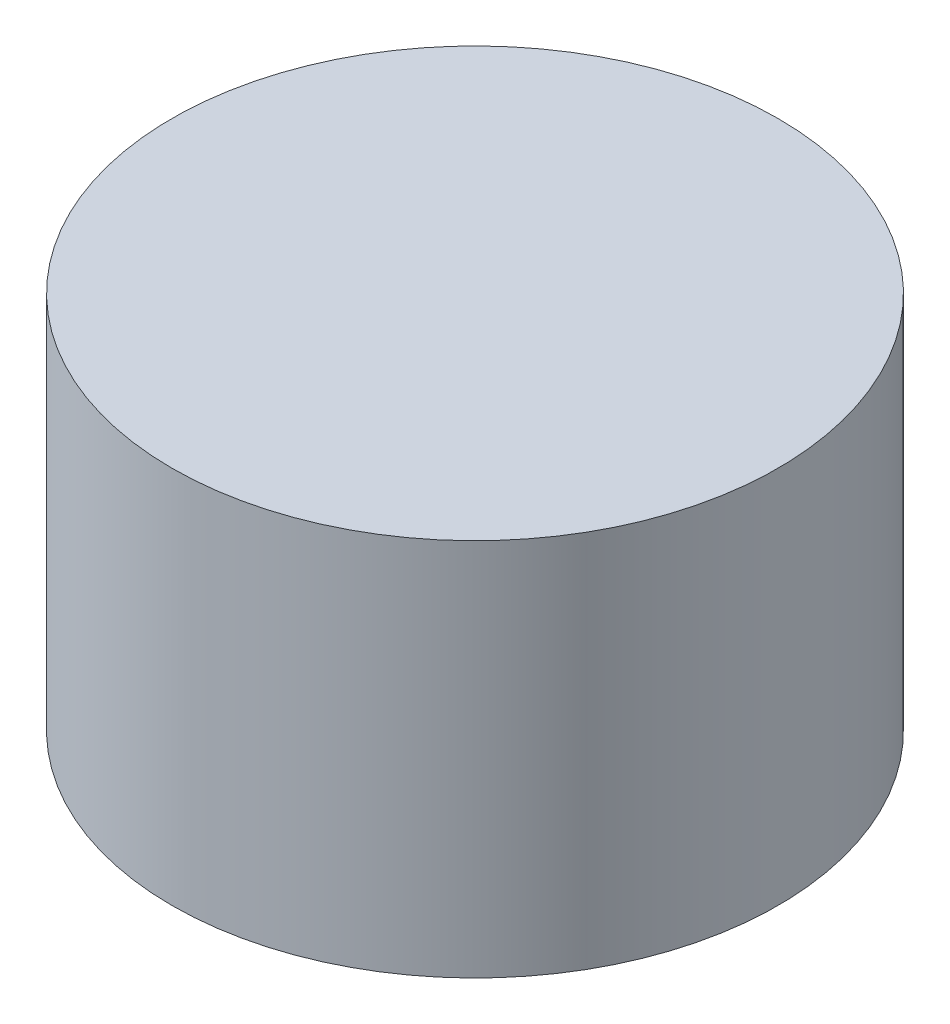
from build123d import *

# Parameters (mm, degrees)
SKETCH1_R           = 40
BOSS_EXTRUDE1_DEPTH = 50
SKETCH3_R           = 3
CUT_EXTRUDE1_DEPTH  = 20


with BuildPart() as part:
    # Sketch1 → Boss-Extrude1 (new body)
    with BuildSketch(Plane(origin=(0, 0, 0), x_dir=(1, 0, 0), z_dir=(0, 1, 0))):
        with Locations(Location((0, 0, 0), (0, 0, 270))):
            Circle(SKETCH1_R)
    extrude(amount=BOSS_EXTRUDE1_DEPTH)

    # Sketch3 → Cut-Extrude1 (cut)
    with BuildSketch(Plane.XZ):
        with Locations(Location((17.67766953, 17.67766953, 0), (0, 0, 270))):
            Circle(SKETCH3_R)
        with Locations(Location((17.67766953, -17.67766953, 0), (0, 0, 270))):
            Circle(SKETCH3_R)
        with Locations(Location((-17.67766953, -17.67766953, 0), (0, 0, 270))):
            Circle(SKETCH3_R)
        with Locations(Location((-17.67766953, 17.67766953, 0), (0, 0, 270))):
            Circle(SKETCH3_R)
    extrude(amount=-CUT_EXTRUDE1_DEPTH, mode=Mode.SUBTRACT)


solid = part.part
